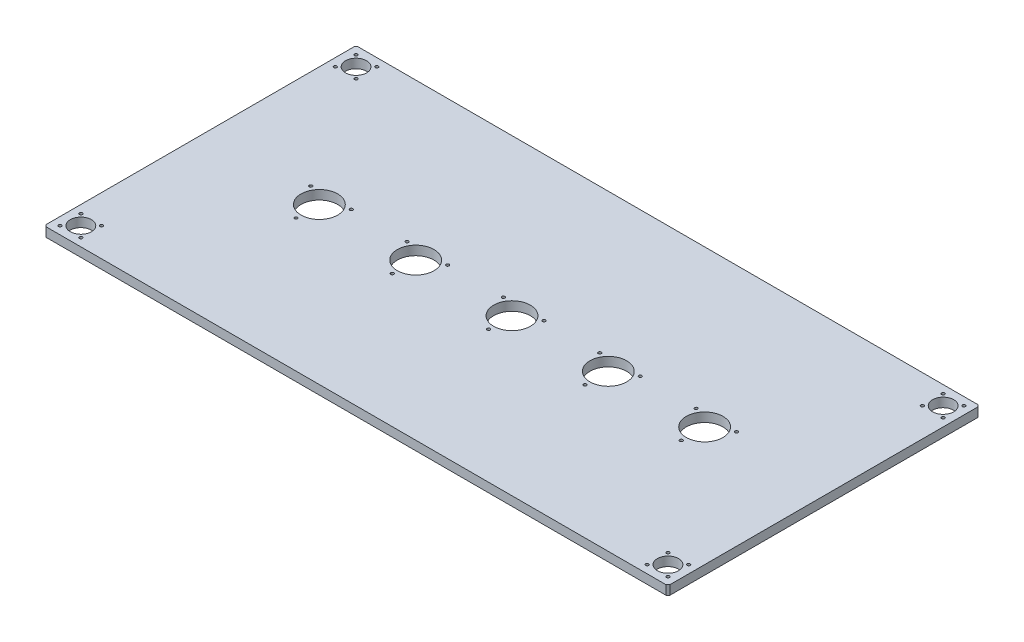
from build123d import *

# Parameters (mm, degrees)
SKETCH1_W             = 680
SKETCH1_H             = 340
SKETCH1_R             = 11.5
SKETCH1_R_2           = 20
BOSS_EXTRUDE1_DEPTH   = 10
CHAMFER1_SIZE         = 2
M4X0_7_TAPPED_HOLE1_D = 3.3
MIRROR2_COPY_1_D      = 3.3
M4X0_7_TAPPED_HOLE2_D = 3.3
LPATTERN1_COUNT       = 3
LPATTERN1_PITCH       = 105
LPATTERN1_COL_COUNT   = 3
LPATTERN1_COL_PITCH   = 105


with BuildPart() as part:
    # Sketch1 → Boss-Extrude1 (new body)
    with BuildSketch(Plane(origin=(0, 0, 0), x_dir=(1, 0, 0), z_dir=(0, 1, 0))):
        Rectangle(SKETCH1_W, SKETCH1_H)
        with Locations(Location((-320, -150, 0), (0, 0, 270))):
            Circle(SKETCH1_R, mode=Mode.SUBTRACT)
        with Locations(Location((0, 0, 0), (0, 0, 270))):
            Circle(SKETCH1_R_2, mode=Mode.SUBTRACT)
        with Locations(Location((-320, 150, 0), (0, 0, 90))):
            Circle(SKETCH1_R, mode=Mode.SUBTRACT)
        with Locations(Location((320, 150, 0), (0, 0, 270))):
            Circle(SKETCH1_R, mode=Mode.SUBTRACT)
        with Locations(Location((320, -150, 0), (0, 0, 90))):
            Circle(SKETCH1_R, mode=Mode.SUBTRACT)
        with Locations(Location((-105, 0, 0), (0, 0, 270))):
            Circle(SKETCH1_R_2, mode=Mode.SUBTRACT)
        with Locations(Location((-210, 0, 0), (0, 0, 270))):
            Circle(SKETCH1_R_2, mode=Mode.SUBTRACT)
        with Locations(Location((105, 0, 0), (0, 0, 90))):
            Circle(SKETCH1_R_2, mode=Mode.SUBTRACT)
        with Locations(Location((210, 0, 0), (0, 0, 90))):
            Circle(SKETCH1_R_2, mode=Mode.SUBTRACT)
    extrude(amount=BOSS_EXTRUDE1_DEPTH)

    # Chamfer1
    chamfer1_edges = [part.edges().sort_by_distance(p)[0] for p in [
        (-340, 5, -170),
        (340, 5, -170),
        (340, 5, 170),
        (-340, 5, 170),
    ]]
    chamfer(chamfer1_edges, length=CHAMFER1_SIZE)

    # M4x0.7 Tapped Hole1 (through all)
    with Locations(Plane(origin=(-331.313708499, 10, 138.686291501), x_dir=(0, 0, 1), z_dir=(0, 1, 0))):
        with Locations((0, 0), (0, 22.627416998), (22.627416998, 22.627416998), (22.627416998, 0)):
            m4x0_7_tapped_hole1 = Hole(M4X0_7_TAPPED_HOLE1_D / 2)

    # Mirror1: M4x0.7 Tapped Hole1 across plane
    add(m4x0_7_tapped_hole1.mirror(Plane.XY), mode=Mode.SUBTRACT)

    # Mirror2: M4x0.7 Tapped Hole1 across plane
    add(m4x0_7_tapped_hole1.mirror(Plane(origin=(0, 0, 0), x_dir=(0, 0, 1), z_dir=(1, 0, 0))), mode=Mode.SUBTRACT)

    # Mirror2 copy 1 (through all)
    with Locations(Plane(origin=(331.313708499, 10, -138.686291501), x_dir=(0, 0, -1), z_dir=(0, 1, 0))):
        with Locations((0, 0), (0, 22.627416998), (22.627416998, 22.627416998), (22.627416998, 0)):
            Hole(MIRROR2_COPY_1_D / 2)

    # M4x0.7 Tapped Hole2 (through all)
    with Locations(Plane(origin=(-22.083647797, 10, -12.75), x_dir=(0, 0, 1), z_dir=(0, 1, 0))):
        with Locations((0, 0), (0, 44.167295594), (38.25, 22.083647797)):
            m4x0_7_tapped_hole2 = Hole(M4X0_7_TAPPED_HOLE2_D / 2)

    # LPattern1: M4x0.7 Tapped Hole2 ×3
    with Locations(*[(i * LPATTERN1_PITCH, 0, 0) for i in range(1, LPATTERN1_COUNT)]):
        add(m4x0_7_tapped_hole2, mode=Mode.SUBTRACT)

    # LPattern1 col: M4x0.7 Tapped Hole2 ×3
    with Locations(*[(-i * LPATTERN1_COL_PITCH, 0, 0) for i in range(1, LPATTERN1_COL_COUNT)]):
        add(m4x0_7_tapped_hole2, mode=Mode.SUBTRACT)


solid = part.part
